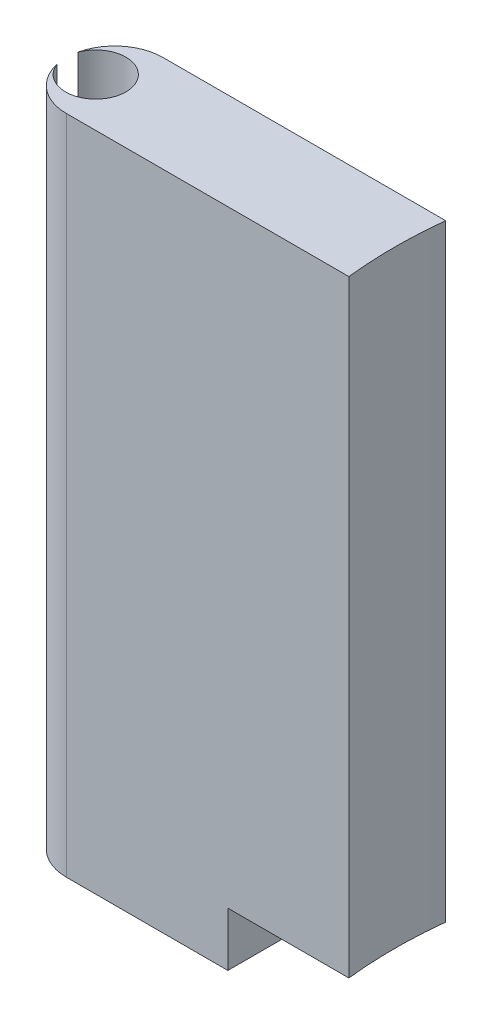
from build123d import *

# Parameters (mm, degrees)
BOSS_EXTRUDE1_DEPTH = 104.14
SKETCH3_R           = 4.75
CUT_EXTRUDE4_DEPTH  = 104.14
SKETCH4_W           = 19.05
SKETCH4_H           = 15.24
CUT_EXTRUDE5_DEPTH  = 8.5
SKETCH5_R           = 3
CUT_EXTRUDE6_DEPTH  = 19.05


with BuildPart() as part:
    # Sketch1 → Boss-Extrude1 (new body)
    with BuildSketch(Plane(origin=(0, 0, 0), x_dir=(1, 0, 0), z_dir=(0, 1, 0))):
        with BuildLine():
            Line((-113.595187486, 7.62), (-69.111187486, 7.62))
            ThreePointArc((-69.111187486, 7.62), (-69.5299981, 0), (-69.111187486, -7.62))
            Line((-69.111187486, -7.62), (-113.595187486, -7.62))
            ThreePointArc((-113.595187486, -7.62), (-121.215187486, 0), (-113.595187486, 7.62))
        make_face()
    extrude(amount=BOSS_EXTRUDE1_DEPTH)

    # Sketch3 → Cut-Extrude4 (cut)
    with BuildSketch(Plane(origin=(0, 104.14, 0), x_dir=(1, 0, 0), z_dir=(0, 1, 0))):
        with Locations((-116.578948711, 0)):
            Circle(SKETCH3_R)
    extrude(amount=-CUT_EXTRUDE4_DEPTH, mode=Mode.SUBTRACT)

    # Sketch4 → Cut-Extrude5 (cut)
    with BuildSketch(Plane.XZ):
        with Locations((-78.636187486, 0)):
            Rectangle(SKETCH4_W, SKETCH4_H)
    extrude(amount=-CUT_EXTRUDE5_DEPTH, mode=Mode.SUBTRACT)

    # Sketch5 → Cut-Extrude6 (cut)
    with BuildSketch(Plane.XZ.offset(-8.5)):
        with Locations(Location((-77.323071778, 0, 0), (0, 0, 270))):
            Circle(SKETCH5_R)
    extrude(amount=-CUT_EXTRUDE6_DEPTH, mode=Mode.SUBTRACT)


solid = part.part
